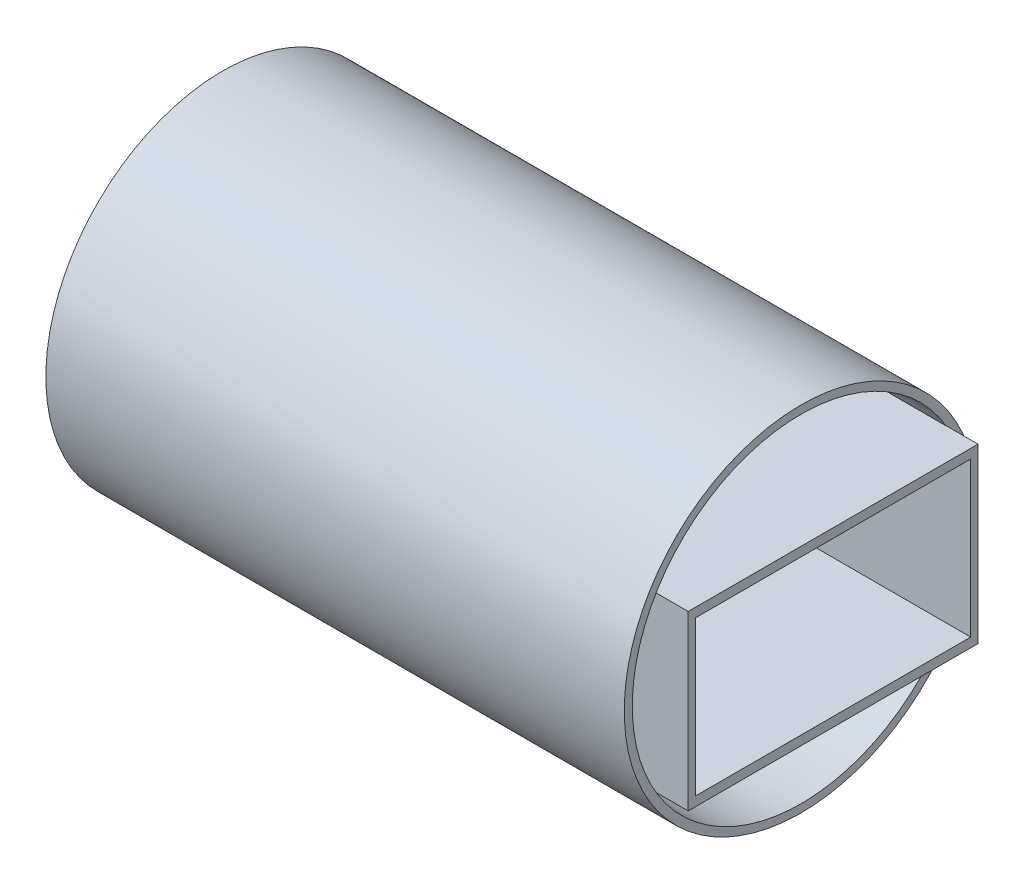
from build123d import *

# Parameters (mm, degrees)
SKETCH1_R           = 139.7
SKETCH1_R_2         = 133.35
BOSS_EXTRUDE1_DEPTH = 457.2
SKETCH2_W           = 229.068065434
SKETCH2_H           = 136.589572802
SKETCH2_W_2         = 217.492134406
SKETCH2_H_2         = 121.92
BOSS_EXTRUDE2_DEPTH = 482.6


with BuildPart() as part:
    # Sketch1 → Boss-Extrude1 (new body)
    with BuildSketch(Plane(origin=(0, 0, 0), x_dir=(0, 0, -1), z_dir=(1, 0, 0))):
        Circle(SKETCH1_R)
        Circle(SKETCH1_R_2, mode=Mode.SUBTRACT)
    extrude(amount=BOSS_EXTRUDE1_DEPTH)


with BuildPart() as body_2:
    # Sketch2 → Boss-Extrude2 (new body)
    with BuildSketch(Plane.ZY):
        Rectangle(SKETCH2_W, SKETCH2_H)
        with Locations((0, 0.054517132)):
            Rectangle(SKETCH2_W_2, SKETCH2_H_2, mode=Mode.SUBTRACT)
    extrude(amount=-BOSS_EXTRUDE2_DEPTH)


solid = Compound([part.part, body_2.part])
